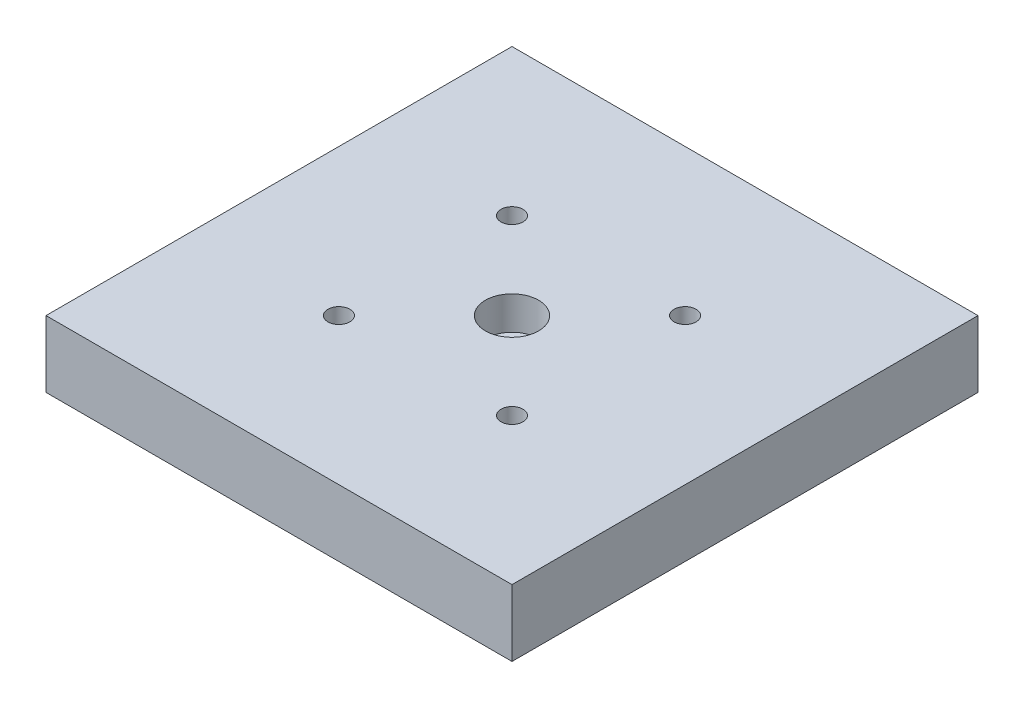
from build123d import *

# Parameters (mm, degrees)
SKETCH1_W           = 70
SKETCH1_H           = 70
BOSS_EXTRUDE1_DEPTH = 10
SKETCH2_R           = 1.65
CUT_EXTRUDE1_DEPTH  = 10
SKETCH3_R           = 4
CUT_EXTRUDE2_DEPTH  = 5


with BuildPart() as part:
    # Sketch1 → Boss-Extrude1 (new body)
    with BuildSketch(Plane(origin=(0, 0, 0), x_dir=(1, 0, 0), z_dir=(0, 1, 0))):
        Rectangle(SKETCH1_W, SKETCH1_H)
    extrude(amount=BOSS_EXTRUDE1_DEPTH)

    # Sketch2 → Cut-Extrude1 (cut)
    with BuildSketch(Plane(origin=(0, 10, 0), x_dir=(1, 0, 0), z_dir=(0, 1, 0))):
        with Locations(Location((-13, 13, 0), (0, 0, 270))):
            Circle(SKETCH2_R)
        with Locations(Location((13, 13, 0), (0, 0, 90))):
            Circle(SKETCH2_R)
        with Locations(Location((13, -13, 0), (0, 0, 270))):
            Circle(SKETCH2_R)
        with Locations(Location((-13, -13, 0), (0, 0, 90))):
            Circle(SKETCH2_R)
    extrude(amount=-CUT_EXTRUDE1_DEPTH, mode=Mode.SUBTRACT)

    # Sketch3 → Cut-Extrude2 (cut)
    with BuildSketch(Plane(origin=(0, 10, 0), x_dir=(1, 0, 0), z_dir=(0, 1, 0))):
        with Locations(Location((0, 0, 0), (0, 0, 270))):
            Circle(SKETCH3_R)
    extrude(amount=-CUT_EXTRUDE2_DEPTH, mode=Mode.SUBTRACT)


solid = part.part
